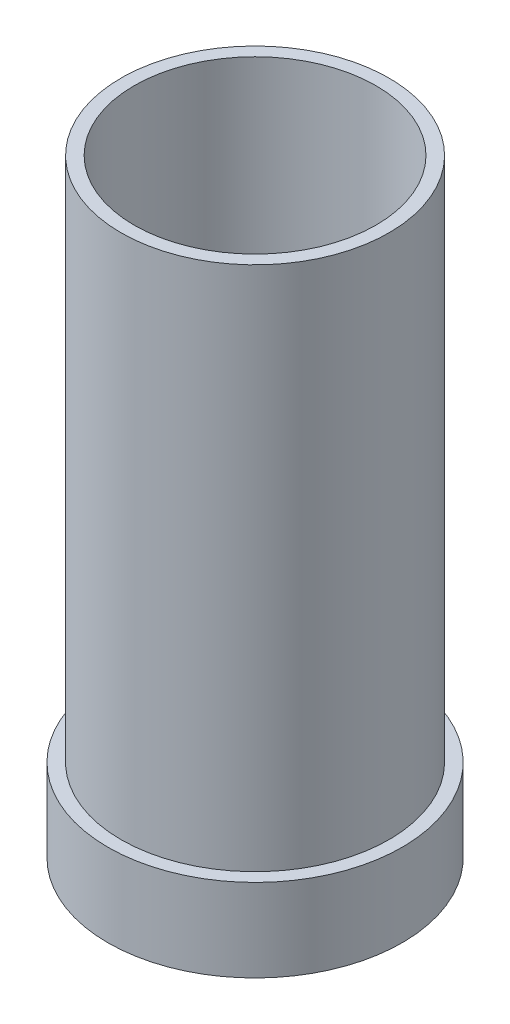
from build123d import *

# Parameters (mm, degrees)
SKETCH1_R           = 3.556
BOSS_EXTRUDE1_DEPTH = 2
SKETCH2_R           = 3.2385
BOSS_EXTRUDE2_DEPTH = 12.7
SKETCH3_R           = 2.921
CUT_EXTRUDE1_DEPTH  = 12.7


with BuildPart() as part:
    # Sketch1 → Boss-Extrude1 (new body)
    with BuildSketch(Plane(origin=(0, 0, 0), x_dir=(1, 0, 0), z_dir=(0, 1, 0))):
        with Locations(Location((0, 0, 0), (0, 0, 270))):
            Circle(SKETCH1_R)
    extrude(amount=BOSS_EXTRUDE1_DEPTH)

    # Sketch2 → Boss-Extrude2 (add)
    with BuildSketch(Plane(origin=(0, 2, 0), x_dir=(1, 0, 0), z_dir=(0, 1, 0))):
        with Locations(Location((0, 0, 0), (0, 0, 270))):
            Circle(SKETCH2_R)
    extrude(amount=BOSS_EXTRUDE2_DEPTH)

    # Sketch3 → Cut-Extrude1 (cut)
    with BuildSketch(Plane(origin=(0, 14.7, 0), x_dir=(1, 0, 0), z_dir=(0, 1, 0))):
        with Locations(Location((0, 0, 0), (0, 0, 270))):
            Circle(SKETCH3_R)
    extrude(amount=-CUT_EXTRUDE1_DEPTH, mode=Mode.SUBTRACT)


solid = part.part
